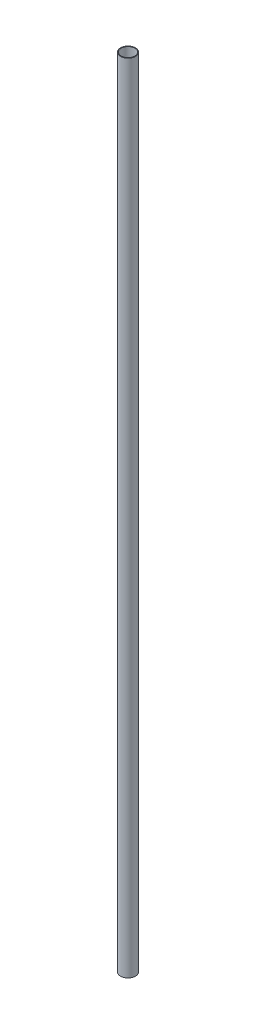
from build123d import *

# Parameters (mm, degrees)
SKETCH1_R          = 9.525
EXTRUDE1_DEPTH     = 1016
SKETCH2_R          = 8.636
CUT_EXTRUDE1_DEPTH = 1016


with BuildPart() as part:
    # Sketch1 → Extrude1 (new body)
    with BuildSketch(Plane(origin=(0, 0, 0), x_dir=(1, 0, 0), z_dir=(0, 1, 0))):
        with Locations(Location((0, 0, 0), (0, 0, 270))):
            Circle(SKETCH1_R)
    extrude(amount=EXTRUDE1_DEPTH)

    # Sketch2 → Cut-Extrude1 (cut)
    with BuildSketch(Plane(origin=(0, 0, 0), x_dir=(1, 0, 0), z_dir=(0, 1, 0))):
        with Locations(Location((0, 0, 0), (0, 0, 270))):
            Circle(SKETCH2_R)
    extrude(amount=CUT_EXTRUDE1_DEPTH, mode=Mode.SUBTRACT)


solid = part.part
